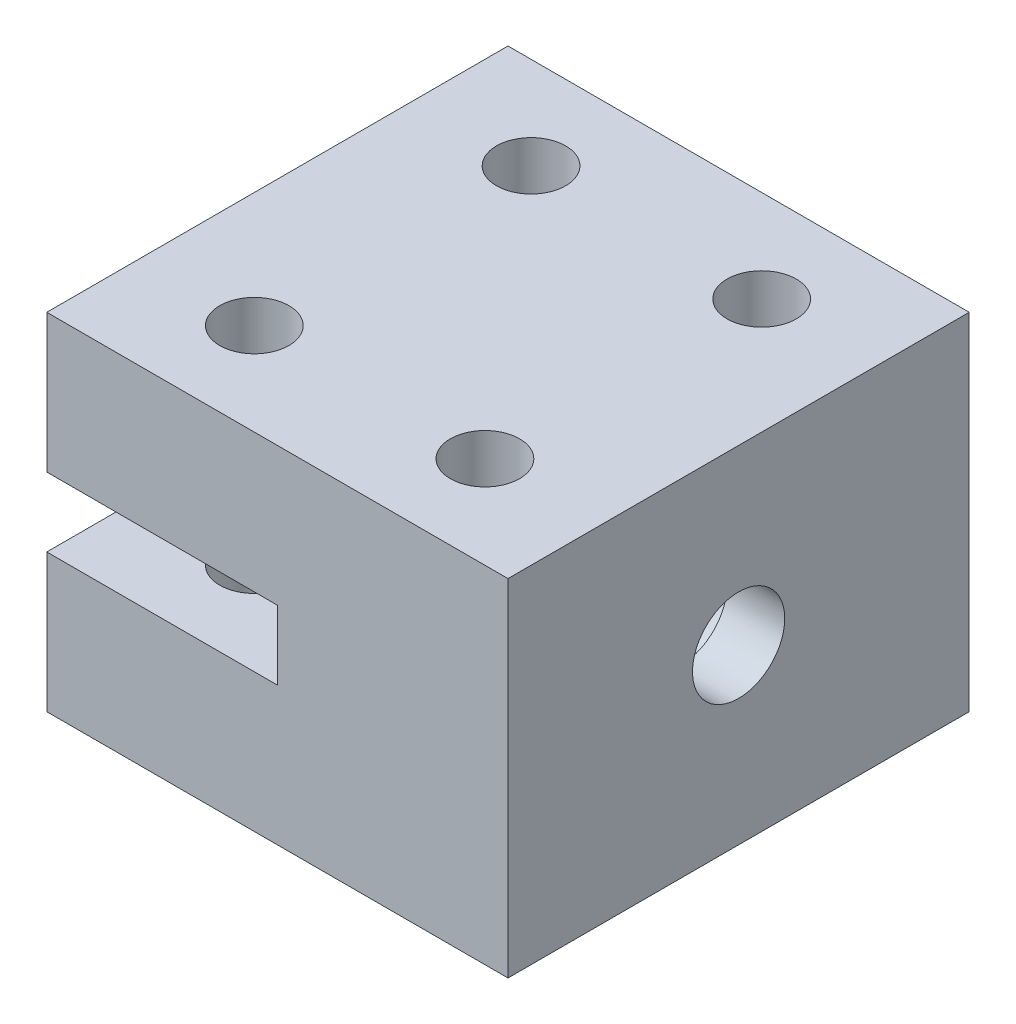
from build123d import *

# Parameters (mm, degrees)
SKETCH1_W            = 20
SKETCH1_H            = 20
BOSS_EXTRUDE1_DEPTH  = 7.5
SKETCH1_3_W          = 20
SKETCH1_3_H          = 20
CUT_EXTRUDE2_DEPTH   = 1.5
SKETCH3_W            = 10
SKETCH3_H            = 20
BOSS_EXTRUDE2_DEPTH  = 1.5
MOUNTHOLE_DEPTH      = 17.007810594
MOUNTHOLE_DEPTH_BACK = 17.007810594
SKETCH5_R            = 1.5
SKETCH6_R            = 3.5
BEARINGHOLE_DEPTH    = 2.5
SKETCH4_R            = 2
SHAFT_DEPTH          = 5


with BuildPart() as part:
    # Sketch1 → Boss-Extrude1 (new, symmetric)
    with BuildSketch(Plane(origin=(0, 0, 0), x_dir=(1, 0, 0), z_dir=(0, 1, 0))):
        Rectangle(SKETCH1_W, SKETCH1_H)
    extrude(amount=BOSS_EXTRUDE1_DEPTH, both=True)

    # Sketch1<3> → Cut-Extrude2 (cut, symmetric)
    with BuildSketch(Plane(origin=(0, 0, 0), x_dir=(1, 0, 0), z_dir=(0, 1, 0))):
        Rectangle(SKETCH1_3_W, SKETCH1_3_H)
    extrude(amount=CUT_EXTRUDE2_DEPTH, both=True, mode=Mode.SUBTRACT)


with BuildPart() as cut_extrude2_piece_1:
    # of the separate pieces the step leaves, piece 1, a body of its own (cut_extrude2_pieces)
    add(part.part.solids().sort_by_distance((-10, -7.5, -10))[0])



with BuildPart() as cut_extrude2_piece_2:
    # of the separate pieces the step leaves, piece 2, a body of its own (cut_extrude2_pieces)
    add(part.part.solids().sort_by_distance((-10, 1.5, -10))[0])


with BuildPart() as cut_extrude2_piece_1_1:
    add(cut_extrude2_piece_1.part)

    add(cut_extrude2_piece_2.part)  # Boss-Extrude2 merges Cut-Extrude2 piece 2
    # Sketch3 → Boss-Extrude2 (add, symmetric)
    with BuildSketch(Plane(origin=(0, 0, 0), x_dir=(1, 0, 0), z_dir=(0, 1, 0))):
        with Locations((5, 0)):
            Rectangle(SKETCH3_W, SKETCH3_H)
    extrude(amount=BOSS_EXTRUDE2_DEPTH, both=True)

    # Sketch5 → mounthole (cut, two sides: drawn at the far end of the back side and taken through both)
    with BuildSketch(Plane(origin=(0, 0, 0), x_dir=(1, 0, 0), z_dir=(0, 1, 0)).offset(-MOUNTHOLE_DEPTH_BACK)):
        with Locations((-5, 6)):
            Circle(SKETCH5_R)
        with Locations((5, 6)):
            Circle(SKETCH5_R)
        with Locations((5, -6)):
            Circle(SKETCH5_R)
        with Locations((-5, -6)):
            Circle(SKETCH5_R)
    extrude(amount=MOUNTHOLE_DEPTH + MOUNTHOLE_DEPTH_BACK, mode=Mode.SUBTRACT)

    # Sketch6 → bearinghole (cut)
    with BuildSketch(Plane(origin=(5, 0, 0), x_dir=(0, 0, -1), z_dir=(1, 0, 0))):
        Circle(SKETCH6_R)
    extrude(amount=BEARINGHOLE_DEPTH, mode=Mode.SUBTRACT)

    # Sketch4 → shaft (cut)
    with BuildSketch(Plane(origin=(10, 0, 0), x_dir=(0, 0, -1), z_dir=(1, 0, 0))):
        Circle(SKETCH4_R)
    extrude(amount=-SHAFT_DEPTH, mode=Mode.SUBTRACT)


solid = cut_extrude2_piece_1_1.part
